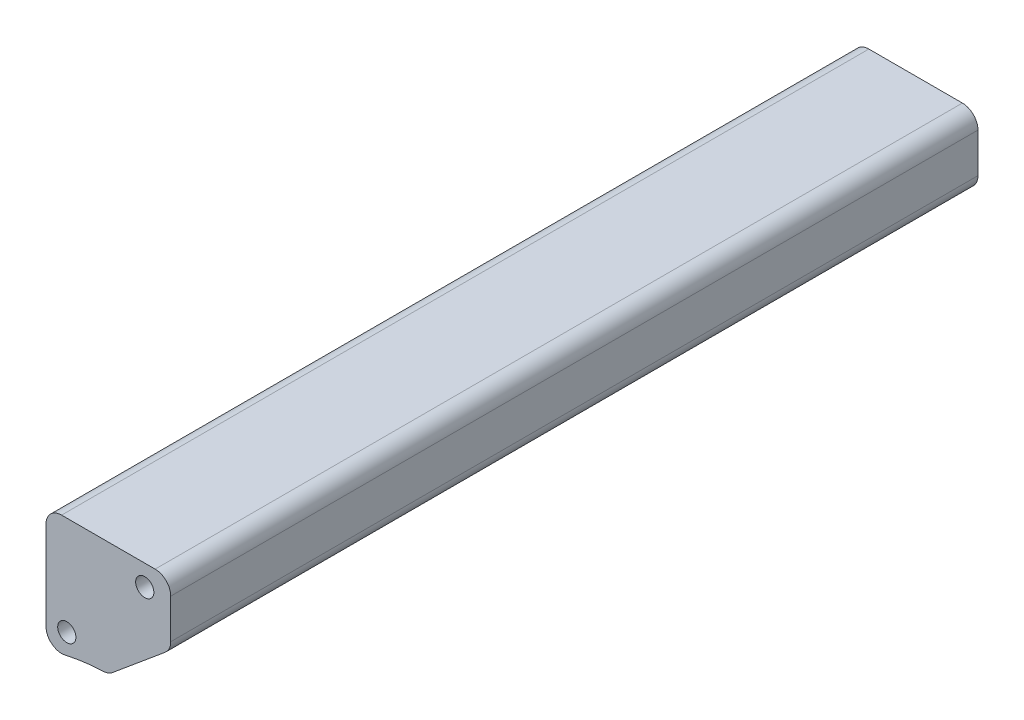
from build123d import *

# Parameters (mm, degrees)
BOSS_EXTRUDE1_DEPTH                    = 77.66
M2_2X0_45_TAPPED_HOLE1_D               = 1.75
M2_2X0_45_TAPPED_HOLE1_DEPTH           = 10
M2_2X0_45_TAPPED_HOLE1_TIP             = 0.525753042
M2_2X0_45_TAPPED_HOLE1_ON_FACE_2_D     = 1.75
M2_2X0_45_TAPPED_HOLE1_ON_FACE_2_DEPTH = 10
M2_2X0_45_TAPPED_HOLE1_ON_FACE_2_TIP   = 0.525753042
FILLET1_R                              = 1.5


with BuildPart() as part:
    # Sketch1 → Boss-Extrude1 (new body)
    with BuildSketch(Plane.XY):
        with BuildLine():
            Line((0, 0), (0, 12))
            Line((0, 12), (12, 12))
            Line((12, 12), (12, 6))
            Line((12, 6), (6, 0.998499343))
            ThreePointArc((6, 0.998499343), (2.961819318, 0.728678054), (0, 0))
        make_face()
    extrude(amount=BOSS_EXTRUDE1_DEPTH)

    # M2.2x0.45 Tapped Hole1
    with Locations(Plane(origin=(2, 2.5, 77.66), x_dir=(1, 0, 0), z_dir=(0, 0, 1))):
        with Locations((0, 0), (7.5, 7.5)):
            Hole(M2_2X0_45_TAPPED_HOLE1_D / 2, depth=M2_2X0_45_TAPPED_HOLE1_DEPTH)
            with Locations((0, 0, -(M2_2X0_45_TAPPED_HOLE1_DEPTH + M2_2X0_45_TAPPED_HOLE1_TIP / 2))):  # 118° drill point
                Cone(0, M2_2X0_45_TAPPED_HOLE1_D / 2, M2_2X0_45_TAPPED_HOLE1_TIP, mode=Mode.SUBTRACT)

    # M2.2x0.45 Tapped Hole1 on face 2
    with Locations(Plane(origin=(2, 2.5, 0), x_dir=(-1, 0, 0), z_dir=(0, 0, -1))):
        with Locations((0, 0), (-7.5, 7.5)):
            Hole(M2_2X0_45_TAPPED_HOLE1_ON_FACE_2_D / 2, depth=M2_2X0_45_TAPPED_HOLE1_ON_FACE_2_DEPTH)
            with Locations((0, 0, -(M2_2X0_45_TAPPED_HOLE1_ON_FACE_2_DEPTH + M2_2X0_45_TAPPED_HOLE1_ON_FACE_2_TIP / 2))):  # 118° drill point
                Cone(0, M2_2X0_45_TAPPED_HOLE1_ON_FACE_2_D / 2, M2_2X0_45_TAPPED_HOLE1_ON_FACE_2_TIP, mode=Mode.SUBTRACT)

    # Fillet1
    fillet1_edges = [part.edges().sort_by_distance(p)[0] for p in [
        (0, 0, 38.83),
        (0, 12, 38.83),
        (12, 12, 38.83),
        (12, 6, 38.83),
        (6, 0.998499343, 38.83),
    ]]
    fillet(fillet1_edges, radius=FILLET1_R)


solid = part.part
